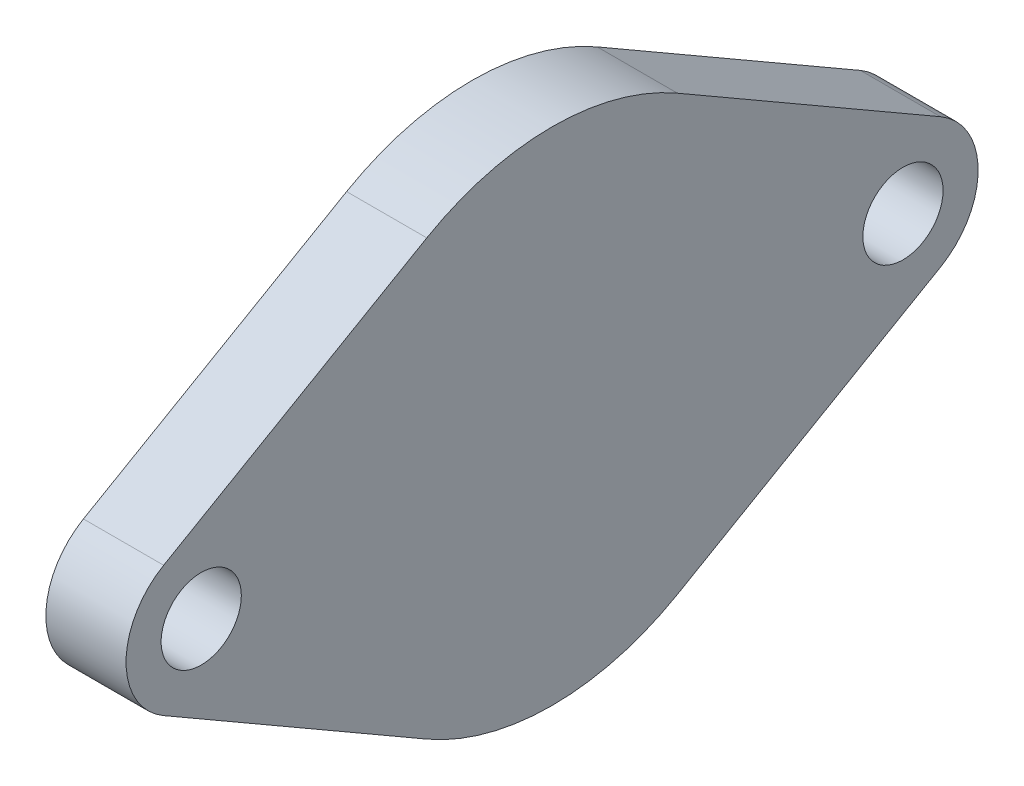
from build123d import *

# Parameters (mm, degrees)
BOSS_EXTRUDE1_DEPTH      = 4
BOSS_EXTRUDE1_DEPTH_BACK = 4
SKETCH1_R                = 4


with BuildPart() as part:
    # Sketch1 → Boss-Extrude1 (new, two sides: drawn at the far end of the back side and taken through both)
    with BuildSketch(Plane(origin=(0, 0, 0), x_dir=(0, 0, -1), z_dir=(1, 0, 0)).offset(-BOSS_EXTRUDE1_DEPTH_BACK)):
        with BuildLine():
            ThreePointArc((-38.75, 6.495190528), (-42.5, 0), (-38.75, -6.495190528))
            Line((-38.75, -6.495190528), (-12.5, -21.650635095))
            ThreePointArc((-12.5, -21.650635095), (0, -25), (12.5, -21.650635095))
            Line((12.5, -21.650635095), (38.75, -6.495190528))
            ThreePointArc((38.75, -6.495190528), (42.5, 0), (38.75, 6.495190528))
            Line((38.75, 6.495190528), (12.5, 21.650635095))
            ThreePointArc((12.5, 21.650635095), (0, 25), (-12.5, 21.650635095))
            Line((-12.5, 21.650635095), (-38.75, 6.495190528))
        make_face()
        with Locations((-35, 0)):
            Circle(SKETCH1_R, mode=Mode.SUBTRACT)
        with Locations((35, 0)):
            Circle(SKETCH1_R, mode=Mode.SUBTRACT)
    extrude(amount=BOSS_EXTRUDE1_DEPTH + BOSS_EXTRUDE1_DEPTH_BACK)


solid = part.part
